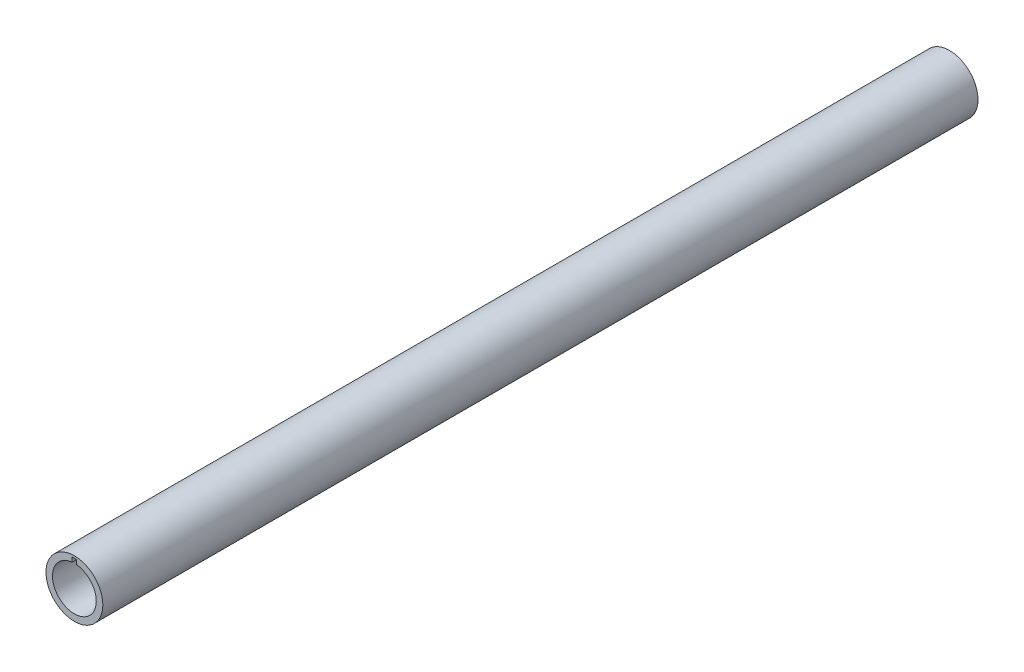
from build123d import *

# Parameters (mm, degrees)
SKETCH1_R           = 13
SKETCH1_R_2         = 10
BOSS_EXTRUDE1_DEPTH = 400
CUT_EXTRUDE1_START  = -20
CUT_EXTRUDE1_DEPTH  = 20
CUT_EXTRUDE2_DEPTH  = 20


with BuildPart() as part:
    # Sketch1 → Boss-Extrude1 (new body)
    with BuildSketch(Plane.XY):
        Circle(SKETCH1_R)
        Circle(SKETCH1_R_2, mode=Mode.SUBTRACT)
    extrude(amount=BOSS_EXTRUDE1_DEPTH)

    # Sketch2 → Cut-Extrude1 (cut)
    with BuildSketch(Plane.XY.offset(400).offset(CUT_EXTRUDE1_START)):
        with BuildLine():
            Line((-1, 9.949874371), (-1, 12))
            Line((-1, 12), (1, 12))
            Line((1, 12), (1, 9.949874371))
            ThreePointArc((1, 9.949874371), (0, 10), (-1, 9.949874371))
        make_face()
    extrude(amount=CUT_EXTRUDE1_DEPTH, mode=Mode.SUBTRACT)

    # Sketch3 → Cut-Extrude2 (cut)
    with BuildSketch(Plane(origin=(0, 0, 0), x_dir=(-1, 0, 0), z_dir=(0, 0, -1))):
        with BuildLine():
            Line((-1, 9.949874371), (-1, 11.949874371))
            Line((-1, 11.949874371), (1, 11.949874371))
            Line((1, 11.949874371), (1, 9.949874371))
            ThreePointArc((1, 9.949874371), (0, 10), (-1, 9.949874371))
        make_face()
    extrude(amount=-CUT_EXTRUDE2_DEPTH, mode=Mode.SUBTRACT)


solid = part.part
